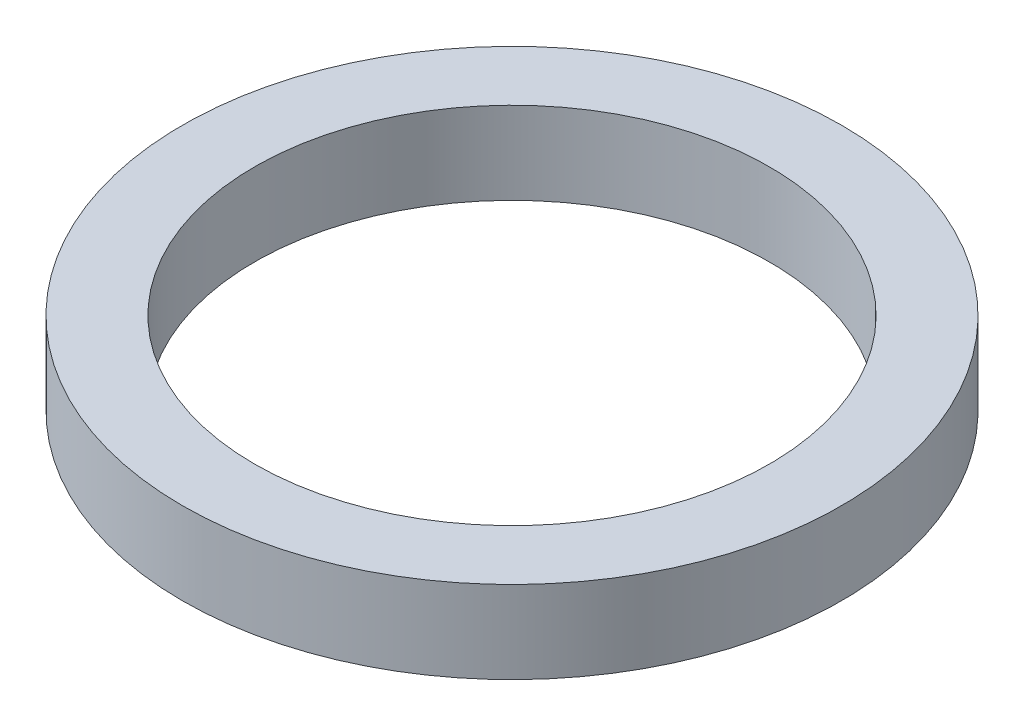
from build123d import *

# Parameters (mm, degrees)
SKETCH_1_R      = 16
SKETCH_1_R_2    = 12.5
EXTRUDE_1_DEPTH = 4


with BuildPart() as part:
    # 草图1 → 凸台-拉伸1 (new body)
    with BuildSketch(Plane(origin=(0, 0, 0), x_dir=(1, 0, 0), z_dir=(0, 1, 0))):
        with Locations(Location((0, 0, 0), (0, 0, 270))):
            Circle(SKETCH_1_R)
        with Locations(Location((0, 0, 0), (0, 0, 270))):
            Circle(SKETCH_1_R_2, mode=Mode.SUBTRACT)
    extrude(amount=EXTRUDE_1_DEPTH)


solid = part.part
